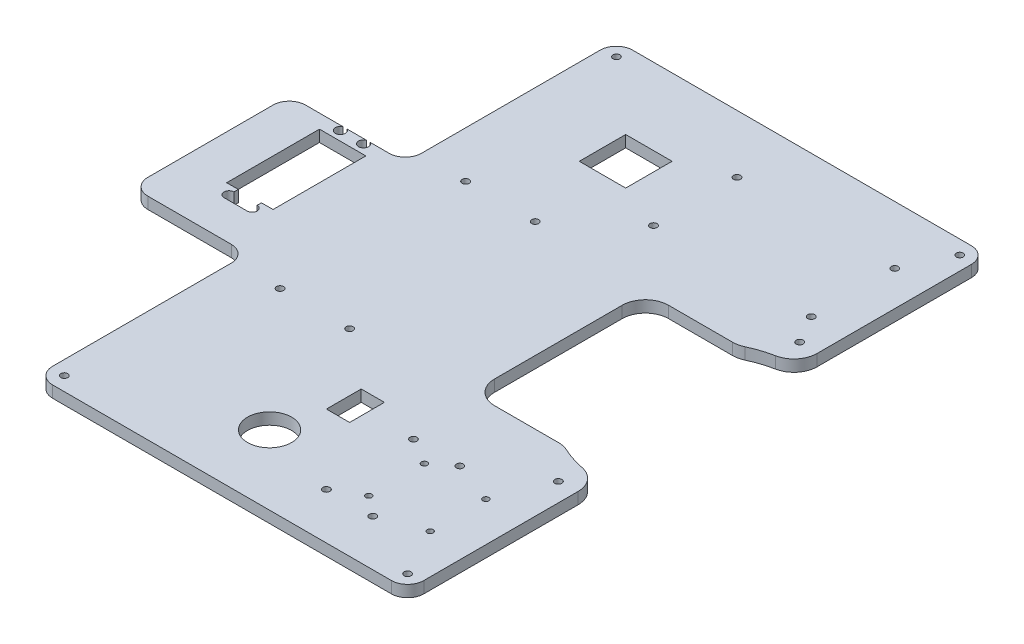
from build123d import *

# Parameters (mm, degrees)
SKETCH_1_R      = 1.5
SKETCH_1_R_2    = 9.5
SKETCH_1_W      = 10
SKETCH_1_H      = 15
SKETCH_1_R_3    = 1.3
SKETCH_1_W_2    = 20
SKETCH_1_H_2    = 20
EXTRUDE_1_DEPTH = 5
FILLET_1_R      = 7
FILLET_2_R      = 10


with BuildPart() as part:
    # 草图1 → 凸台-拉伸1 (new body)
    with BuildSketch(Plane(origin=(0, 0, 0), x_dir=(1, 0, 0), z_dir=(0, 1, 0))):
        with BuildLine():
            Line((160, 0), (0, 0))
            Line((0, 0), (0, -91))
            Line((0, -91), (-15.211013308, -91))
            ThreePointArc((-15.211013308, -91), (-14.22252688, -91.790417714), (-13.85, -93))
            ThreePointArc((-13.85, -93), (-17.209582286, -94.77747312), (-16.788986692, -91))
            Line((-16.788986692, -91), (-25.211013308, -91))
            ThreePointArc((-25.211013308, -91), (-24.22252688, -91.790417714), (-23.85, -93))
            ThreePointArc((-23.85, -93), (-27.209582286, -94.77747312), (-26.788986692, -91))
            Line((-26.788986692, -91), (-50, -91))
            Line((-50, -91), (-50, -159))
            Line((-50, -159), (0, -159))
            Line((0, -159), (0, -250))
            Line((0, -250), (160, -250))
            Line((160, -250), (160, -167.5))
            ThreePointArc((160, -167.5), (149.692235936, -166.231056256), (140, -162.5))
            Line((140, -162.5), (100, -162.5))
            Line((100, -162.5), (100, -87.5))
            Line((100, -87.5), (140, -87.5))
            ThreePointArc((140, -87.5), (149.692235936, -83.768943744), (160, -82.5))
            Line((160, -82.5), (160, 0))
        make_face()
        with Locations(Location((6, -244, 0), (0, 0, 270))):
            Circle(SKETCH_1_R, mode=Mode.SUBTRACT)
        with Locations(Location((20, -165, 0), (0, 0, 270))):
            Circle(SKETCH_1_R, mode=Mode.SUBTRACT)
        with Locations(Location((50, -165, 0), (0, 0, 270))):
            Circle(SKETCH_1_R, mode=Mode.SUBTRACT)
        with Locations(Location((70.5, -220, 0), (0, 0, 270))):
            Circle(SKETCH_1_R_2, mode=Mode.SUBTRACT)
        with Locations(Location((105, -230, 0), (0, 0, 270))):
            Circle(SKETCH_1_R, mode=Mode.SUBTRACT)
        with Locations((80, -192.5)):
            Rectangle(SKETCH_1_W, SKETCH_1_H, mode=Mode.SUBTRACT)
        with Locations(Location((105, -192.5, 0), (0, 0, 270))):
            Circle(SKETCH_1_R, mode=Mode.SUBTRACT)
        with Locations(Location((116.5, -223.25, 0), (0, 0, 270))):
            Circle(SKETCH_1_R_3, mode=Mode.SUBTRACT)
        with Locations(Location((125, -230, 0), (0, 0, 270))):
            Circle(SKETCH_1_R, mode=Mode.SUBTRACT)
        with Locations(Location((154, -244, 0), (0, 0, 270))):
            Circle(SKETCH_1_R, mode=Mode.SUBTRACT)
        with Locations(Location((143, -223.25, 0), (0, 0, 270))):
            Circle(SKETCH_1_R_3, mode=Mode.SUBTRACT)
        with Locations(Location((116.5, -199.25, 0), (0, 0, 270))):
            Circle(SKETCH_1_R_3, mode=Mode.SUBTRACT)
        with Locations(Location((125, -192.5, 0), (0, 0, 270))):
            Circle(SKETCH_1_R, mode=Mode.SUBTRACT)
        with Locations(Location((143, -199.25, 0), (0, 0, 270))):
            Circle(SKETCH_1_R_3, mode=Mode.SUBTRACT)
        with Locations(Location((152, -177, 0), (0, 0, 270))):
            Circle(SKETCH_1_R, mode=Mode.SUBTRACT)
        with BuildLine():
            Line((-31, -137), (-31, -97))
            Line((-31, -97), (-11, -97))
            Line((-11, -97), (-11, -137))
            Line((-11, -137), (-16, -137))
            Line((-16, -137), (-16, -138.85))
            ThreePointArc((-16, -138.85), (-13.85, -141), (-16, -143.15))
            Line((-16, -143.15), (-26, -143.15))
            ThreePointArc((-26, -143.15), (-28.15, -141), (-26, -138.85))
            Line((-26, -138.85), (-26, -137))
            Line((-26, -137), (-31, -137))
        make_face(mode=Mode.SUBTRACT)
        with Locations(Location((20, -85, 0), (0, 0, 270))):
            Circle(SKETCH_1_R, mode=Mode.SUBTRACT)
        with Locations(Location((50, -85, 0), (0, 0, 270))):
            Circle(SKETCH_1_R, mode=Mode.SUBTRACT)
        with Locations((47, -43)):
            Rectangle(SKETCH_1_W_2, SKETCH_1_H_2, mode=Mode.SUBTRACT)
        with Locations(Location((6, -6, 0), (0, 0, 270))):
            Circle(SKETCH_1_R, mode=Mode.SUBTRACT)
        with Locations(Location((152, -73, 0), (0, 0, 270))):
            Circle(SKETCH_1_R, mode=Mode.SUBTRACT)
        with Locations(Location((77, -61, 0), (0, 0, 270))):
            Circle(SKETCH_1_R, mode=Mode.SUBTRACT)
        with Locations(Location((77, -25, 0), (0, 0, 270))):
            Circle(SKETCH_1_R, mode=Mode.SUBTRACT)
        with Locations(Location((145, -61, 0), (0, 0, 270))):
            Circle(SKETCH_1_R, mode=Mode.SUBTRACT)
        with Locations(Location((145, -25, 0), (0, 0, 270))):
            Circle(SKETCH_1_R, mode=Mode.SUBTRACT)
        with Locations(Location((154, -6, 0), (0, 0, 270))):
            Circle(SKETCH_1_R, mode=Mode.SUBTRACT)
    extrude(amount=EXTRUDE_1_DEPTH)

    # 圆角1
    fillet_1_edges = [part.edges().sort_by_distance(p)[0] for p in [
        (0, 2.5, 91),
        (0, 2.5, 0),
        (160, 2.5, 0),
        (160, 2.5, 250),
        (0, 2.5, 250),
        (0, 2.5, 159),
        (-50, 2.5, 159),
        (-50, 2.5, 91),
    ]]
    fillet(fillet_1_edges, radius=FILLET_1_R)

    # 圆角2
    fillet_2_edges = [part.edges().sort_by_distance(p)[0] for p in [
        (160, 2.5, 82.5),
        (140, 2.5, 87.5),
        (100, 2.5, 87.5),
        (100, 2.5, 162.5),
        (140, 2.5, 162.5),
        (160, 2.5, 167.5),
    ]]
    fillet(fillet_2_edges, radius=FILLET_2_R)


solid = part.part
